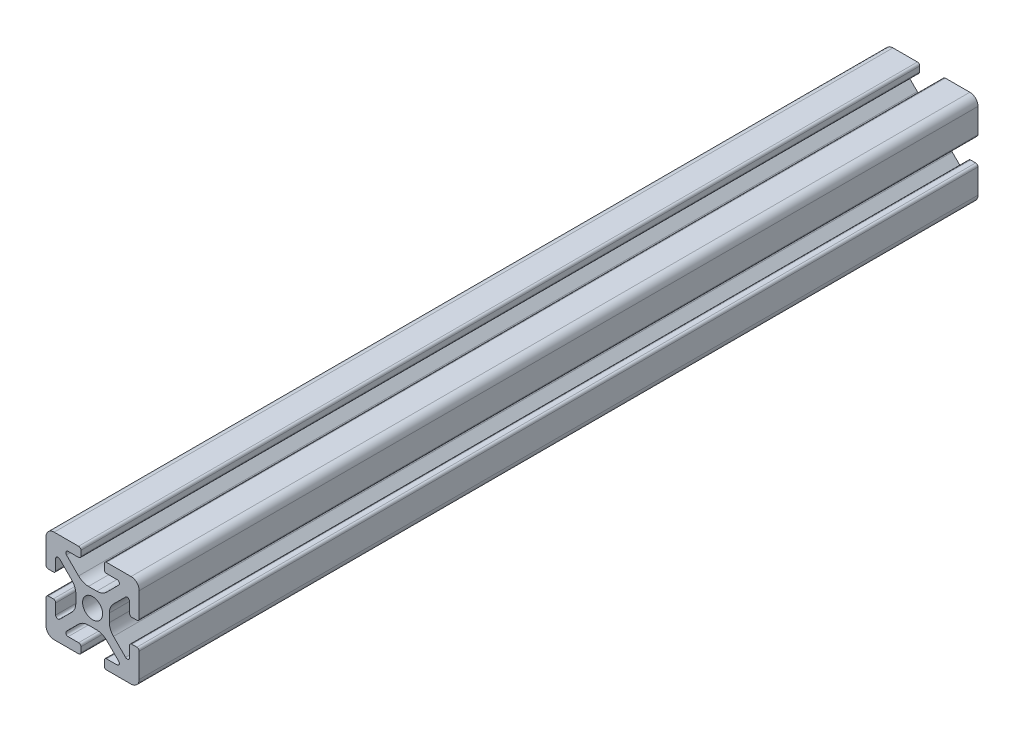
from build123d import *

# Parameters (mm, degrees)
BOSS_EXTRUDE1_DEPTH = 90


with BuildPart() as part:
    # Sketch4 → Boss-Extrude1 (new, symmetric)
    with BuildSketch(Plane.XY):
        with BuildLine():
            Line((3, -10), (8.25, -10))
            ThreePointArc((8.25, -10), (9.487436867, -9.487436867), (10, -8.25))
            Line((10, -8.25), (10, -3))
            ThreePointArc((10, -3), (9.853553391, -2.646446609), (9.5, -2.5))
            Line((9.5, -2.5), (8.424621202, -2.5))
            ThreePointArc((8.424621202, -2.5), (8.071067812, -2.646446609), (7.924621202, -3))
            Line((7.924621202, -3), (7.924621202, -5.25))
            ThreePointArc((7.924621202, -5.25), (7.615962919, -5.711939766), (7.071067812, -5.603553391))
            Line((7.071067812, -5.603553391), (4.478679656, -3.011165235))
            ThreePointArc((4.478679656, -3.011165235), (3.828361402, -2.037895189), (3.6, -0.889844892))
            Line((3.6, -0.889844892), (3.6, 0))
            Line((3.6, 0), (2.15, 0))
            ThreePointArc((2.15, 0), (1.52027958, -1.52027958), (0, -2.15))
            Line((0, -2.15), (0, -3.6))
            Line((0, -3.6), (0.889844892, -3.6))
            ThreePointArc((0.889844892, -3.6), (2.037895189, -3.828361402), (3.011165235, -4.478679656))
            Line((3.011165235, -4.478679656), (5.603553391, -7.071067812))
            ThreePointArc((5.603553391, -7.071067812), (5.711939766, -7.615962919), (5.25, -7.924621202))
            Line((5.25, -7.924621202), (3, -7.924621202))
            ThreePointArc((3, -7.924621202), (2.646446609, -8.071067812), (2.5, -8.424621202))
            Line((2.5, -8.424621202), (2.5, -9.5))
            ThreePointArc((2.5, -9.5), (2.646446609, -9.853553391), (3, -10))
        make_face()
    extrude(amount=BOSS_EXTRUDE1_DEPTH, both=True)

    # Mirror1: part across plane


with BuildPart() as part_1:
    add(part.part)
    add(part.part.mirror(Plane(origin=(0, 0, 0), x_dir=(0, 0, 1), z_dir=(1, 0, 0))))

    # Mirror2: part across plane


with BuildPart() as part_2:
    add(part_1.part)
    add(part_1.part.mirror(Plane.ZX))


solid = part_2.part
